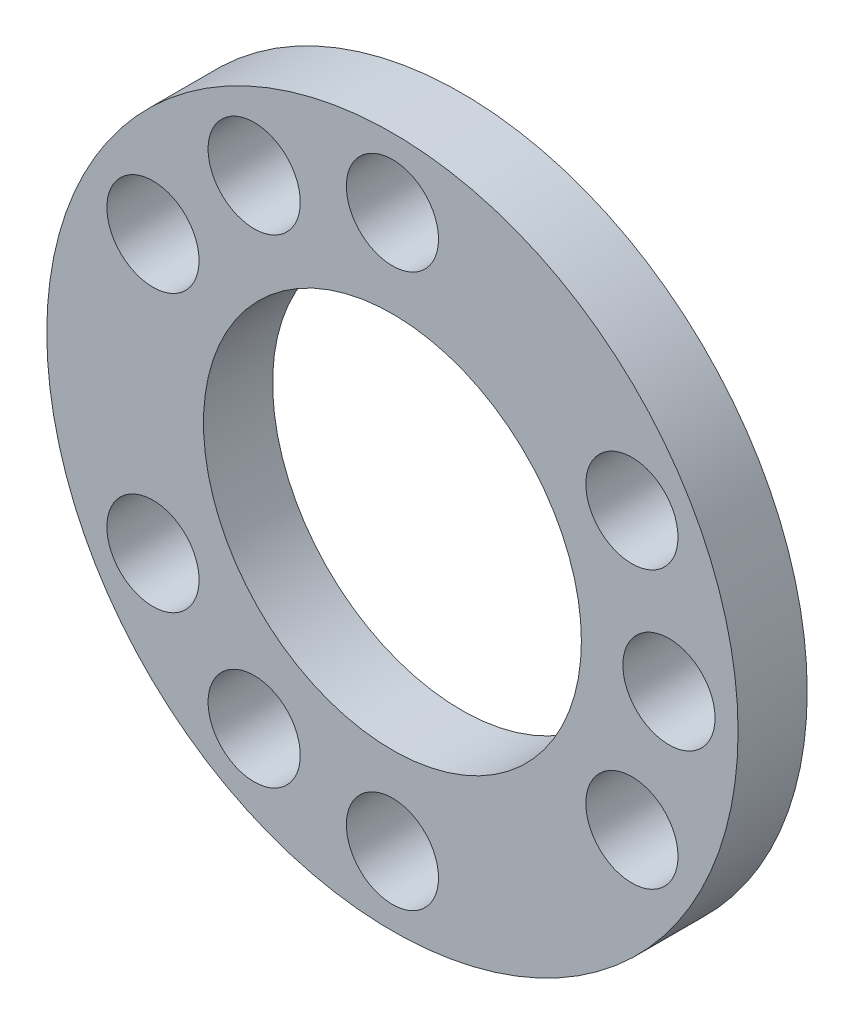
from build123d import *

# Parameters (mm, degrees)
SKETCH_1_R          = 15
SKETCH_1_R_2        = 2
SKETCH_1_R_3        = 5
EXTRUDE_1_DEPTH     = 7
SKETCH_2_R          = 8
SKETCH_2_R_2        = 5
EXTRUDE_2_DEPTH     = 70
SKETCH_3_R          = 2.5
CUT_EXTRUDE_1_DEPTH = 10
CUT_EXTRUDE_START   = -4
SKETCH_4_R          = 18.074037985
SKETCH_4_R_2        = 8
CUT_EXTRUDE_2_DEPTH = 4
SKETCH_5_R          = 8.2
CUT_EXTRUDE_3_DEPTH = 90


with BuildPart() as part:
    # 草图1 → 凸台-拉伸1 (new body)
    with BuildSketch(Plane.XY):
        Circle(SKETCH_1_R)
        with Locations((0, 12)):
            Circle(SKETCH_1_R_2, mode=Mode.SUBTRACT)
        with Locations((10.392304845, 6)):
            Circle(SKETCH_1_R_2, mode=Mode.SUBTRACT)
        with Locations((10.392304845, -6)):
            Circle(SKETCH_1_R_2, mode=Mode.SUBTRACT)
        with Locations((0, -12)):
            Circle(SKETCH_1_R_2, mode=Mode.SUBTRACT)
        with Locations((-10.392304845, -6)):
            Circle(SKETCH_1_R_2, mode=Mode.SUBTRACT)
        with Locations((-10.392304845, 6)):
            Circle(SKETCH_1_R_2, mode=Mode.SUBTRACT)
        with Locations((-6, 10.392304845)):
            Circle(SKETCH_1_R_2, mode=Mode.SUBTRACT)
        with Locations((12, 0)):
            Circle(SKETCH_1_R_2, mode=Mode.SUBTRACT)
        with Locations((-6, -10.392304845)):
            Circle(SKETCH_1_R_2, mode=Mode.SUBTRACT)
        Circle(SKETCH_1_R_3, mode=Mode.SUBTRACT)
    extrude(amount=EXTRUDE_1_DEPTH)

    # 草图2 → 凸台-拉伸2 (add)
    with BuildSketch(Plane.XY.offset(7)):
        Circle(SKETCH_2_R)
        Circle(SKETCH_2_R_2, mode=Mode.SUBTRACT)
    extrude(amount=EXTRUDE_2_DEPTH)

    # 草图3 → 切除-拉伸1 (cut)
    with BuildSketch(Plane(origin=(0, 0, 0), x_dir=(1, 0, 0), z_dir=(0, 1, 0))):
        with Locations(Location((0.676832819, -59, 0), (0, 0, 270))):
            Circle(SKETCH_3_R)
    extrude(amount=-CUT_EXTRUDE_1_DEPTH, mode=Mode.SUBTRACT)

    # 草图4 → 切除-拉伸2 (cut)
    with BuildSketch(Plane.XY.offset(7).offset(CUT_EXTRUDE_START)):
        Circle(SKETCH_4_R)
        Circle(SKETCH_4_R_2, mode=Mode.SUBTRACT)
    extrude(amount=CUT_EXTRUDE_2_DEPTH, mode=Mode.SUBTRACT)

    # 草图5 → 切除-拉伸3 (cut)
    with BuildSketch(Plane.XY.offset(77)):
        Circle(SKETCH_5_R)
    extrude(amount=-CUT_EXTRUDE_3_DEPTH, mode=Mode.SUBTRACT)


solid = part.part
